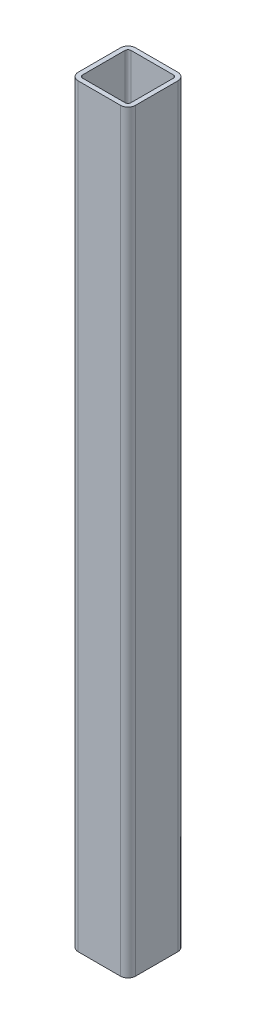
from build123d import *

# Parameters (mm, degrees)
SKETCH1_W           = 38
SKETCH1_H           = 38
BOSS_EXTRUDE1_DEPTH = 250
FILLET1_R           = 5
SHELL1_T            = -3


with BuildPart() as part:
    # Sketch1 → Boss-Extrude1 (new, symmetric)
    with BuildSketch(Plane(origin=(0, 0, 0), x_dir=(1, 0, 0), z_dir=(0, 1, 0))):
        Rectangle(SKETCH1_W, SKETCH1_H)
    extrude(amount=BOSS_EXTRUDE1_DEPTH, both=True)

    # Fillet1
    fillet1_edges = [part.edges().sort_by_distance(p)[0] for p in [
        (19, 0, 19),
        (-19, 0, 19),
        (-19, 0, -19),
        (19, 0, -19),
    ]]
    fillet(fillet1_edges, radius=FILLET1_R)

    # Shell1
    shell1_openings = [part.faces().sort_by_distance(p)[0] for p in [
        (0, 250, 0),
        (0, -250, 0),
    ]]
    offset(amount=SHELL1_T, openings=shell1_openings, kind=Kind.INTERSECTION)


solid = part.part
